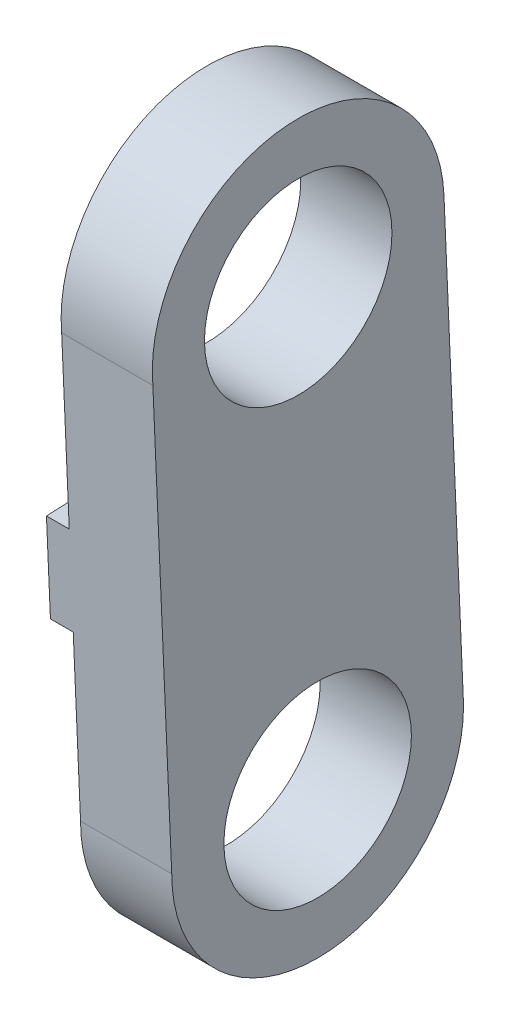
from build123d import *

# Parameters (mm, degrees)
SKETCH1_R           = 3.2639
BOSS_EXTRUDE1_DEPTH = 3.175
BOSS_EXTRUDE2_DEPTH = 0.79375


with BuildPart() as part:
    # Sketch1 → Boss-Extrude1 (new body)
    with BuildSketch(Plane(origin=(0, 0, 0), x_dir=(0, 0, -1), z_dir=(1, 0, 0))):
        with BuildLine():
            Line((172.062748254, 15.053539887), (172.72, 0))
            ThreePointArc((172.72, 0), (177.8, -5.08), (182.88, 0))
            Line((182.88, 0), (182.198650149, 15.716317735))
            ThreePointArc((182.198650149, 15.716317735), (176.791948401, 20.565465387), (172.062748254, 15.053539887))
        make_face()
        with Locations((177.8, 0)):
            Circle(SKETCH1_R, mode=Mode.SUBTRACT)
        with Locations((177.123417321, 15.496291061)):
            Circle(SKETCH1_R, mode=Mode.SUBTRACT)
    extrude(amount=BOSS_EXTRUDE1_DEPTH)

    # Sketch2 → Boss-Extrude2 (add)
    with BuildSketch(Plane.ZY):
        Polygon((-182.539325075, 7.858158868), (-182.60808341, 6.272148609), (-172.465486686, 5.829313272), (-172.326859023, 9.004408754), (-182.470566739, 9.444169127), align=None)
    extrude(amount=BOSS_EXTRUDE2_DEPTH)


solid = part.part
